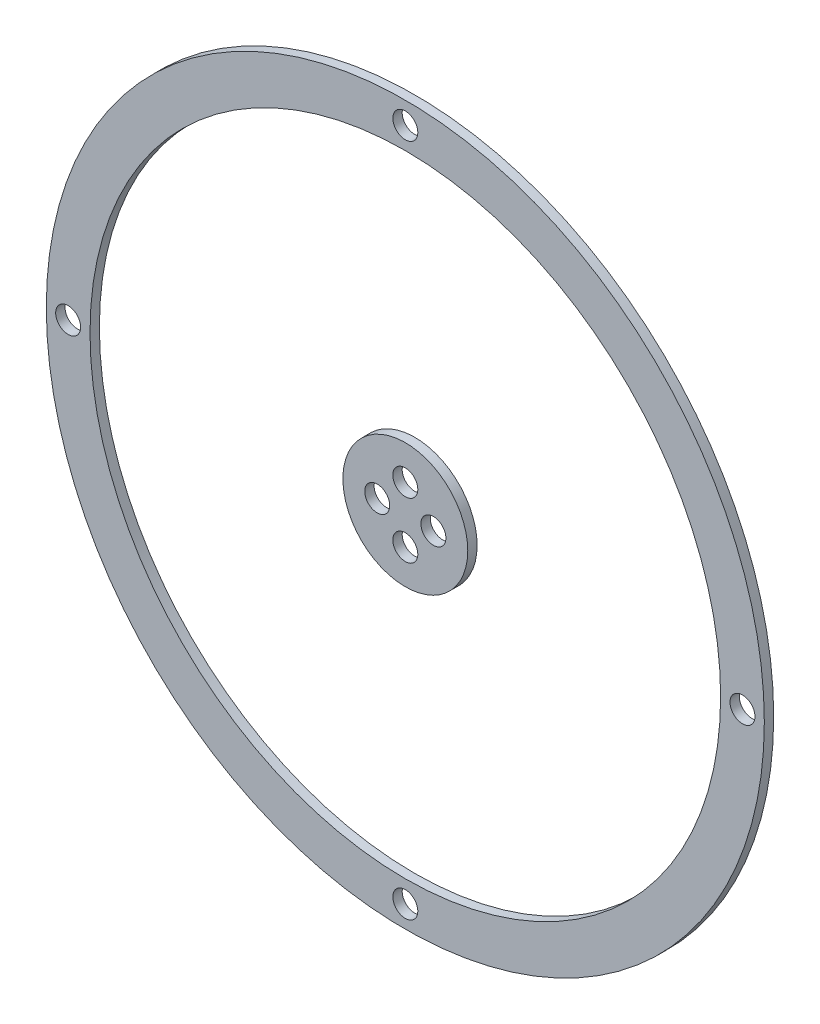
from build123d import *

# Parameters (mm, degrees)
CROQUIS1_R                = 57.5
CROQUIS1_R_2              = 2
CROQUIS1_R_3              = 50.5
SALIENTE_EXTRUIR1_DEPTH   = 1.5
CROQUIS1_R_4              = 10
SALIENTE_EXTRUIR1_2_DEPTH = 1.5


with BuildPart() as part:
    # Croquis1 → Saliente-Extruir1 (new body)
    with BuildSketch(Plane.XY):
        Circle(CROQUIS1_R)
        with Locations((-54, 0)):
            Circle(CROQUIS1_R_2, mode=Mode.SUBTRACT)
        with Locations((0, -54)):
            Circle(CROQUIS1_R_2, mode=Mode.SUBTRACT)
        with Locations((54, 0)):
            Circle(CROQUIS1_R_2, mode=Mode.SUBTRACT)
        Circle(CROQUIS1_R_3, mode=Mode.SUBTRACT)
        with Locations((0, 54)):
            Circle(CROQUIS1_R_2, mode=Mode.SUBTRACT)
    extrude(amount=SALIENTE_EXTRUIR1_DEPTH)


with BuildPart() as body_2:
    # Croquis1 → Saliente-Extruir1 2 (new body)
    with BuildSketch(Plane.XY):
        Circle(CROQUIS1_R_4)
        with Locations((-4.5, 0)):
            Circle(CROQUIS1_R_2, mode=Mode.SUBTRACT)
        with Locations((0, -4.5)):
            Circle(CROQUIS1_R_2, mode=Mode.SUBTRACT)
        with Locations((4.5, 0)):
            Circle(CROQUIS1_R_2, mode=Mode.SUBTRACT)
        with Locations((0, 4.5)):
            Circle(CROQUIS1_R_2, mode=Mode.SUBTRACT)
    extrude(amount=SALIENTE_EXTRUIR1_2_DEPTH)


solid = Compound([part.part, body_2.part])
